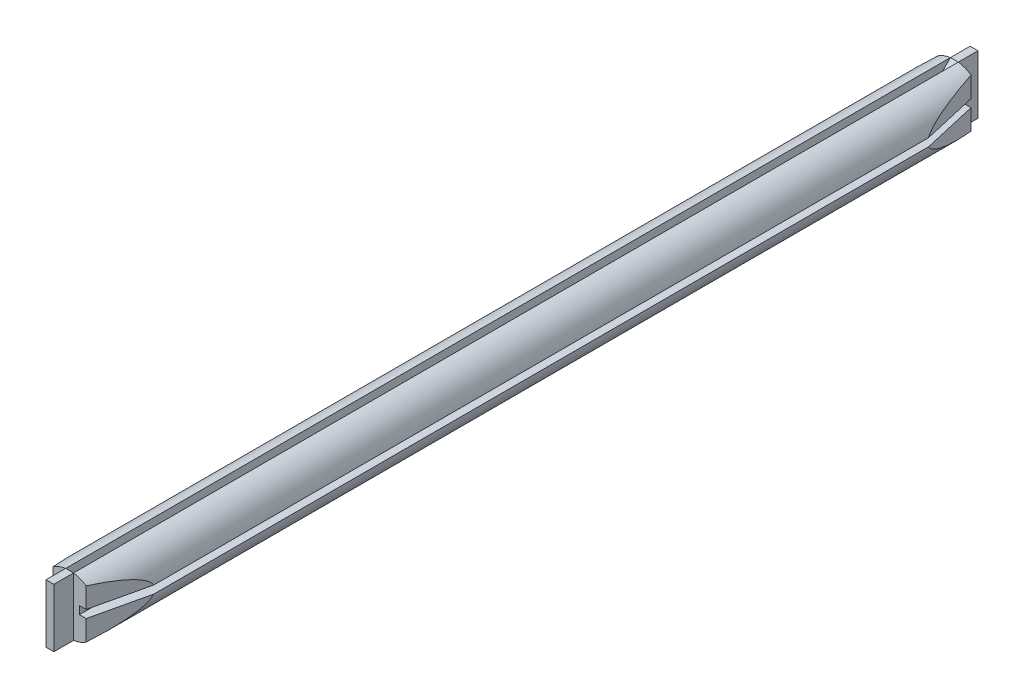
from build123d import *

# Parameters (mm, degrees)
BOSS_EXTRUDE1_DEPTH = 1125
CUT_EXTRUDE1_DEPTH  = 110
BOSS_EXTRUDE2_DEPTH = 20
SKETCH4_W           = 20
SKETCH4_H           = 74.330343737
SKETCH4_H_2         = 74.330343736
BOSS_EXTRUDE3_DEPTH = 50


with BuildPart() as part:
    # Sketch1 → Boss-Extrude1 (new body)
    with BuildSketch(Plane.XY):
        with BuildLine():
            Line((77.675695624, -8.540198176), (28.345351887, -8.540198176))
            Line((28.345351887, -8.540198176), (28.345351887, -28.540198176))
            Line((28.345351887, -28.540198176), (77.675695624, -28.540198176))
            ThreePointArc((77.675695624, -28.540198176), (56.378360476, -71.573206765), (13.345351887, -92.870541913))
            Line((13.345351887, -92.870541913), (13.345351887, -43.540198176))
            Line((13.345351887, -43.540198176), (-6.654648113, -43.540198176))
            Line((-6.654648113, -43.540198176), (-6.654648113, -92.870541913))
            ThreePointArc((-6.654648113, -92.870541913), (-49.687656702, -71.573206765), (-70.984991849, -28.540198176))
            Line((-70.984991849, -28.540198176), (-21.654648113, -28.540198176))
            Line((-21.654648113, -28.540198176), (-21.654648113, -8.540198176))
            Line((-21.654648113, -8.540198176), (-70.984991849, -8.540198176))
            ThreePointArc((-70.984991849, -8.540198176), (-49.687656702, 34.492810412), (-6.654648113, 55.79014556))
            Line((-6.654648113, 55.79014556), (-6.654648113, 6.459801824))
            Line((-6.654648113, 6.459801824), (13.345351887, 6.459801824))
            Line((13.345351887, 6.459801824), (13.345351887, 55.79014556))
            ThreePointArc((13.345351887, 55.79014556), (56.378360476, 34.492810412), (77.675695624, -8.540198176))
        make_face()
    boss_extrude1 = extrude(amount=BOSS_EXTRUDE1_DEPTH)

    # Sketch2 → Cut-Extrude1 (cut, symmetric)
    with BuildSketch(Plane(origin=(0, 0, 0), x_dir=(1, 0, 0), z_dir=(0, 1, 0))):
        Polygon((-70.984991849, -140), (-38.819819981, 0), (-70.984991849, 0), align=None)
        Polygon((77.675695624, 0), (45.510523755, 0), (77.675695624, -140), align=None)
    cut_extrude1 = extrude(amount=CUT_EXTRUDE1_DEPTH, both=True, mode=Mode.SUBTRACT)

    # Sketch3 → Boss-Extrude2 (add)
    with BuildSketch(Plane(origin=(-6.654648113, 0, 0), x_dir=(0, 0, -1), z_dir=(1, 0, 0))):
        Polygon((0, 55.79014556), (0, -92.870541913), (-74.330343737, -18.540198176), align=None)
    boss_extrude2 = extrude(amount=BOSS_EXTRUDE2_DEPTH)

    # Sketch4 → Boss-Extrude3 (add)
    with BuildSketch(Plane(origin=(0, 0, 0), x_dir=(-1, 0, 0), z_dir=(0, 0, -1))):
        with Locations((-3.345351887, -55.705370045)):
            Rectangle(SKETCH4_W, SKETCH4_H)
        with Locations((-3.345351887, 18.624973692)):
            Rectangle(SKETCH4_W, SKETCH4_H_2)
    boss_extrude3 = extrude(amount=BOSS_EXTRUDE3_DEPTH)

    # Mirror1: Boss-Extrude1, Cut-Extrude1, Boss-Extrude2, Boss-Extrude3 across plane
    add(boss_extrude1.mirror(Plane.XY.offset(1125)))
    add(cut_extrude1.mirror(Plane.XY.offset(1125)), mode=Mode.SUBTRACT)
    add(boss_extrude2.mirror(Plane.XY.offset(1125)))
    add(boss_extrude3.mirror(Plane.XY.offset(1125)))


solid = part.part
